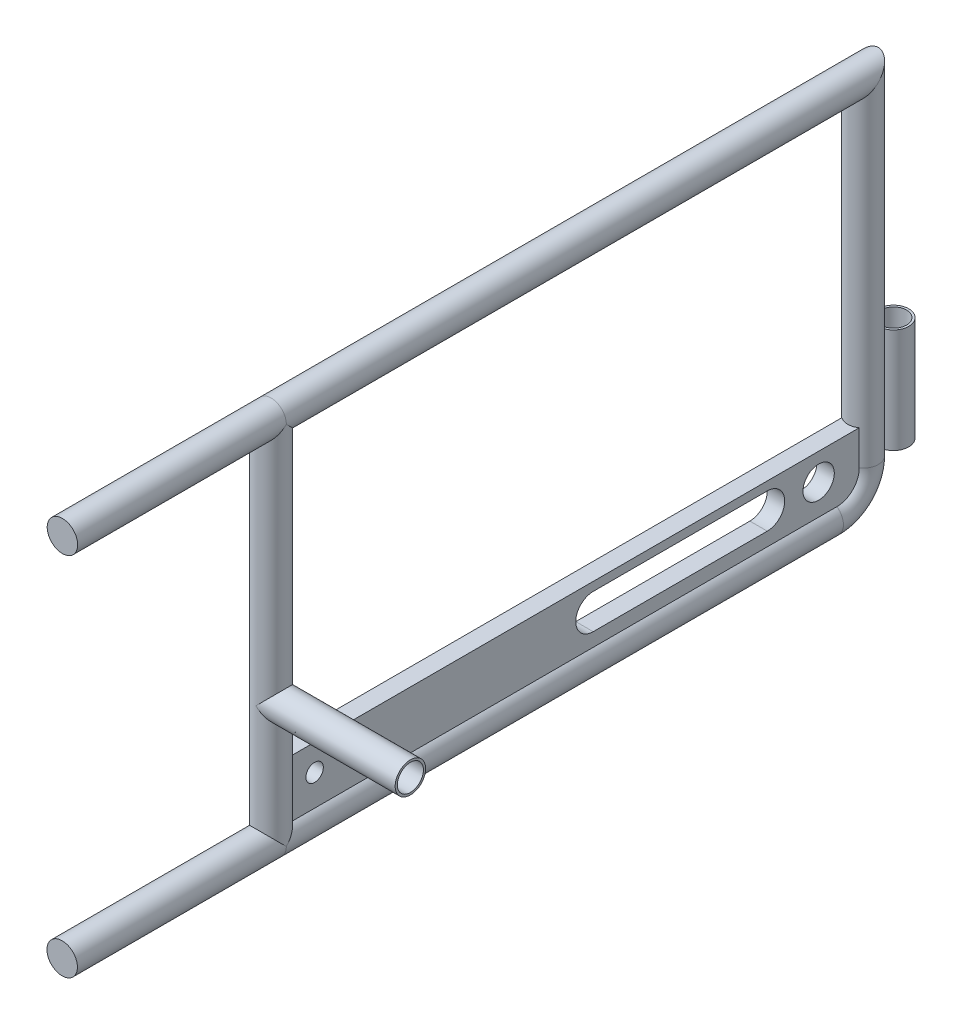
from build123d import *
from build123d.topology import SkipClean

# Parameters (mm, degrees)
SKETCH3_R               = 11.1125
SKETCH3_8_R             = 11.1125
SKETCH11_R              = 6.35
BOSS_EXTRUDE2_DEPTH     = 6.35
SKETCH12_R              = 11.1125
SKETCH12_R_2            = 9.525
BOSS_EXTRUDE3_DEPTH     = 101.6
SKETCH13_R              = 11.1125
SKETCH13_R_2            = 9.525
BOSS_EXTRUDE4_DEPTH     = 76.2
CUT_EXTRUDE2_DEPTH      = 947.041134319
CUT_EXTRUDE2_DEPTH_BACK = 947.041134319
SKETCH14_R              = 11.43


with BuildPart() as part:
    # Sweep1: sweep along a path in Sketch1
    with BuildLine(Plane(origin=(0, 0, 0), x_dir=(0, 0, -1), z_dir=(1, 0, 0))) as sweep1_path:
        Line((0, -431.8), (152.212779539, -431.8))
        Line((152.212779539, -431.8), (584.012779539, -431.8))
        Line((584.012779539, -431.8), (584.012779539, -673.1))
        ThreePointArc((584.012779539, -673.1), (576.573291781, -691.060512242), (558.612779539, -698.5))
        Line((558.612779539, -698.5), (152.212779539, -698.5))
        Line((152.212779539, -698.5), (-0.187220461, -698.5))
    # Sketch3 → Sweep1 (sweep)
    with BuildSketch(Plane.XY):
        with Locations((0, -698.5)):
            Circle(SKETCH3_R)
    sweep(path=sweep1_path.line, transition=Transition.RIGHT)

    # Sweep2: sweep along a path in Sketch1<23>
    with BuildLine(Plane(origin=(0, 0, 0), x_dir=(0, 0, -1), z_dir=(1, 0, 0))) as sweep2_path:
        Line((-0.187220461, -698.5), (152.212779539, -698.5))
        Line((152.212779539, -698.5), (152.212779539, -431.8))
    # Sketch3<8> → Sweep2 (sweep)
    with BuildSketch(Plane.XY):
        with Locations((0, -698.5)):
            Circle(SKETCH3_8_R)
    sweep(path=sweep2_path.line, transition=Transition.RIGHT)

    # Sketch11 → Boss-Extrude2 (add, symmetric)
    with BuildSketch(Plane(origin=(0, 0, 0), x_dir=(0, 0, -1), z_dir=(1, 0, 0))):
        with BuildLine():
            Line((584.012779539, -673.1), (584.012779539, -647.7))
            Line((584.012779539, -647.7), (152.212779539, -647.7))
            Line((152.212779539, -647.7), (152.212779539, -698.5))
            Line((152.212779539, -698.5), (558.612779539, -698.5))
            ThreePointArc((558.612779539, -698.5), (576.573291781, -691.060512242), (584.012779539, -673.1))
        make_face()
        with BuildLine():
            ThreePointArc((380.812779539, -679.45), (368.112779539, -666.75), (380.812779539, -654.05))
            Line((380.812779539, -654.05), (507.812779539, -654.05))
            ThreePointArc((507.812779539, -654.05), (520.512779539, -666.75), (507.812779539, -679.45))
            Line((507.812779539, -679.45), (380.812779539, -679.45))
        make_face(mode=Mode.SUBTRACT)
        with Locations((177.612779539, -666.75)):
            Circle(SKETCH11_R, mode=Mode.SUBTRACT)
    extrude(amount=BOSS_EXTRUDE2_DEPTH, both=True)

    # Sketch12 → Boss-Extrude3 (add)
    with SkipClean():  # the faces are left unmerged after this step: merging them gives an invalid solid
        with BuildSketch(Plane(origin=(0, 0, 0), x_dir=(0, 0, -1), z_dir=(1, 0, 0))):
            with Locations((152.212779539, -609.6)):
                Circle(SKETCH12_R)
            with Locations((152.212779539, -609.6)):
                Circle(SKETCH12_R_2, mode=Mode.SUBTRACT)
        extrude(amount=BOSS_EXTRUDE3_DEPTH)

    # Sketch14 → Cut-Extrude2 (cut, two sides: drawn at the far end of the back side and taken through both)
    with SkipClean():  # the faces are left unmerged after this step: merging them gives an invalid solid
        with BuildSketch(Plane(origin=(0, 0, 0), x_dir=(0, 0, -1), z_dir=(1, 0, 0)).offset(-CUT_EXTRUDE2_DEPTH_BACK)):
            with Locations((545.269475056, -667.231739767)):
                Circle(SKETCH14_R)
        extrude(amount=CUT_EXTRUDE2_DEPTH + CUT_EXTRUDE2_DEPTH_BACK, mode=Mode.SUBTRACT)


with BuildPart() as body_2:
    # Sketch13 → Boss-Extrude4 (new body)
    with BuildSketch(Plane(origin=(0, -673.1, 0), x_dir=(1, 0, 0), z_dir=(0, 1, 0))):
        with Locations((0, 606.237779539)):
            Circle(SKETCH13_R)
        with Locations((0, 606.237779539)):
            Circle(SKETCH13_R_2, mode=Mode.SUBTRACT)
    extrude(amount=BOSS_EXTRUDE4_DEPTH)


solid = Compound([part.part, body_2.part])
